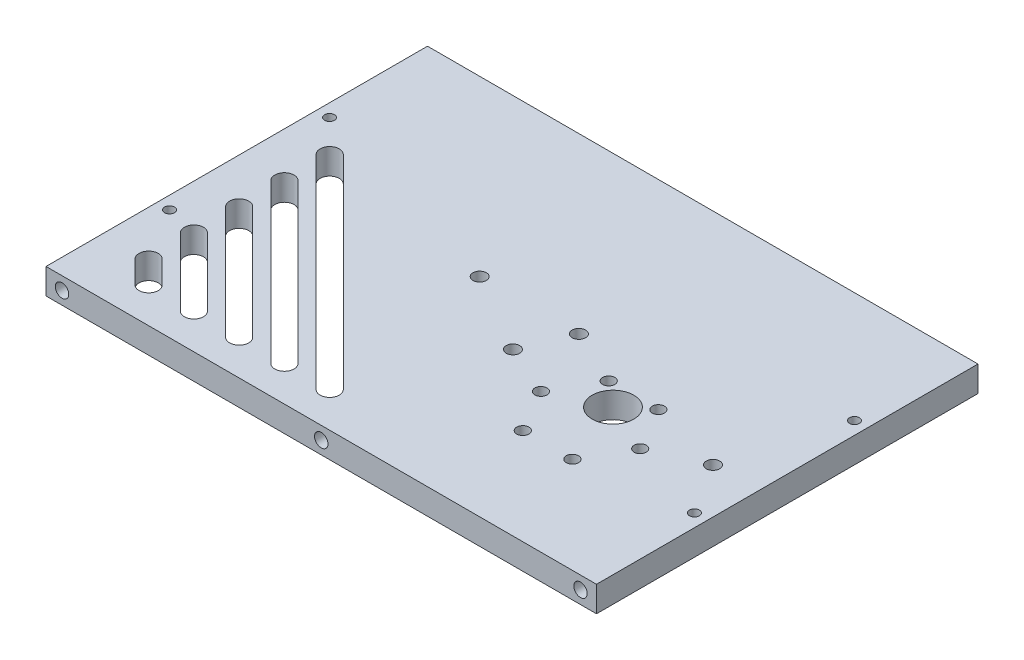
from build123d import *

# Parameters (mm, degrees)
SKETCH1_W           = 172
SKETCH1_H           = 119.2019
BOSS_EXTRUDE1_DEPTH = 8
CUT_EXTRUDE1_REACH  = 211.421
SKETCH2_R           = 6.5
SKETCH2_R_2         = 1.9
SKETCH2_R_3         = 2.1
SKETCH3_R           = 2.1
CUT_EXTRUDE2_DEPTH  = 15
CUT_EXTRUDE3_START  = -104.2019
SKETCH3_3_R         = 2.1
CUT_EXTRUDE3_DEPTH  = 15
CUT_EXTRUDE4_REACH  = 211.421
SKETCH4_R           = 1.55


with BuildPart() as part:
    # Sketch1 → Boss-Extrude1 (new body)
    with BuildSketch(Plane(origin=(0, 0, 0), x_dir=(-1, 0, 0), z_dir=(0, 1, 0))):
        with Locations((86, 59.60095)):
            Rectangle(SKETCH1_W, SKETCH1_H)
    extrude(amount=BOSS_EXTRUDE1_DEPTH)

    # Sketch2 → Cut-Extrude1 (cut, up to next)
    with BuildSketch(Plane.XZ, mode=Mode.PRIVATE) as cut_extrude1_sk1:
        with Locations(Location((-45.35, 68.7019, 0), (0, 0, 270))):
            Circle(SKETCH2_R)
    cut_extrude1_tool1 = extrude(cut_extrude1_sk1.sketch, amount=-CUT_EXTRUDE1_REACH, mode=Mode.PRIVATE) & part.part
    # Sketch2 → Cut-Extrude1 (cut, up to next)
    with BuildSketch(Plane.XZ, mode=Mode.PRIVATE) as cut_extrude1_sk2:
        with Locations(Location((-60.85, 75.7019, 0), (0, 0, 270))):
            Circle(SKETCH2_R_2)
    cut_extrude1_tool2 = extrude(cut_extrude1_sk2.sketch, amount=-CUT_EXTRUDE1_REACH, mode=Mode.PRIVATE) & part.part
    # Sketch2 → Cut-Extrude1 (cut, up to next)
    with BuildSketch(Plane.XZ, mode=Mode.PRIVATE) as cut_extrude1_sk3:
        with Locations(Location((-53.1, 89.125293759, 0), (0, 0, 270))):
            Circle(SKETCH2_R_2)
    cut_extrude1_tool3 = extrude(cut_extrude1_sk3.sketch, amount=-CUT_EXTRUDE1_REACH, mode=Mode.PRIVATE) & part.part
    # Sketch2 → Cut-Extrude1 (cut, up to next)
    with BuildSketch(Plane.XZ, mode=Mode.PRIVATE) as cut_extrude1_sk4:
        with Locations(Location((-37.6, 89.125293759, 0), (0, 0, 270))):
            Circle(SKETCH2_R_2)
    cut_extrude1_tool4 = extrude(cut_extrude1_sk4.sketch, amount=-CUT_EXTRUDE1_REACH, mode=Mode.PRIVATE) & part.part
    # Sketch2 → Cut-Extrude1 (cut, up to next)
    with BuildSketch(Plane.XZ, mode=Mode.PRIVATE) as cut_extrude1_sk5:
        with Locations(Location((-29.85, 75.7019, 0), (0, 0, 270))):
            Circle(SKETCH2_R_2)
    cut_extrude1_tool5 = extrude(cut_extrude1_sk5.sketch, amount=-CUT_EXTRUDE1_REACH, mode=Mode.PRIVATE) & part.part
    # Sketch2 → Cut-Extrude1 (cut, up to next)
    with BuildSketch(Plane.XZ, mode=Mode.PRIVATE) as cut_extrude1_sk6:
        with Locations(Location((-37.6, 62.278506241, 0), (0, 0, 270))):
            Circle(SKETCH2_R_2)
    cut_extrude1_tool6 = extrude(cut_extrude1_sk6.sketch, amount=-CUT_EXTRUDE1_REACH, mode=Mode.PRIVATE) & part.part
    # Sketch2 → Cut-Extrude1 (cut, up to next)
    with BuildSketch(Plane.XZ, mode=Mode.PRIVATE) as cut_extrude1_sk7:
        with Locations(Location((-53.1, 62.278506241, 0), (0, 0, 270))):
            Circle(SKETCH2_R_2)
    cut_extrude1_tool7 = extrude(cut_extrude1_sk7.sketch, amount=-CUT_EXTRUDE1_REACH, mode=Mode.PRIVATE) & part.part
    # Sketch2 → Cut-Extrude1 (cut, up to next)
    with BuildSketch(Plane.XZ, mode=Mode.PRIVATE) as cut_extrude1_sk8:
        with Locations(Location((-76.6, 68.7019, 0), (0, 0, 270))):
            Circle(SKETCH2_R_3)
    cut_extrude1_tool8 = extrude(cut_extrude1_sk8.sketch, amount=-CUT_EXTRUDE1_REACH, mode=Mode.PRIVATE) & part.part
    # Sketch2 → Cut-Extrude1 (cut, up to next)
    with BuildSketch(Plane.XZ, mode=Mode.PRIVATE) as cut_extrude1_sk9:
        with Locations(Location((-14.1, 68.7019, 0), (0, 0, 270))):
            Circle(SKETCH2_R_3)
    cut_extrude1_tool9 = extrude(cut_extrude1_sk9.sketch, amount=-CUT_EXTRUDE1_REACH, mode=Mode.PRIVATE) & part.part
    # Sketch2 → Cut-Extrude1 (cut, up to next)
    with BuildSketch(Plane.XZ, mode=Mode.PRIVATE) as cut_extrude1_sk10:
        with Locations(Location((-70.5, 54.2019, 0), (0, 0, 270))):
            Circle(SKETCH2_R_3)
    cut_extrude1_tool10 = extrude(cut_extrude1_sk10.sketch, amount=-CUT_EXTRUDE1_REACH, mode=Mode.PRIVATE) & part.part
    # Sketch2 → Cut-Extrude1 (cut, up to next)
    with BuildSketch(Plane.XZ, mode=Mode.PRIVATE) as cut_extrude1_sk11:
        with Locations(Location((-101.5, 54.2019, 0), (0, 0, 270))):
            Circle(SKETCH2_R_3)
    cut_extrude1_tool11 = extrude(cut_extrude1_sk11.sketch, amount=-CUT_EXTRUDE1_REACH, mode=Mode.PRIVATE) & part.part
    # Sketch2 → Cut-Extrude1 (cut, up to next)
    with BuildSketch(Plane.XZ, mode=Mode.PRIVATE) as cut_extrude1_sk12:
        with BuildLine():
            Line((-160.121320344, 89.110016908), (-138.908116908, 110.323220344))
            ThreePointArc((-138.908116908, 110.323220344), (-134.665476221, 110.323220344), (-134.665476221, 106.080579656))
            Line((-134.665476221, 106.080579656), (-155.878679656, 84.867376221))
            ThreePointArc((-155.878679656, 84.867376221), (-160.121320344, 84.867376221), (-160.121320344, 89.110016908))
        make_face()
    cut_extrude1_tool12 = extrude(cut_extrude1_sk12.sketch, amount=-CUT_EXTRUDE1_REACH, mode=Mode.PRIVATE) & part.part
    # Sketch2 → Cut-Extrude1 (cut, up to next)
    with BuildSketch(Plane.XZ, mode=Mode.PRIVATE) as cut_extrude1_sk13:
        with BuildLine():
            Line((-160.121320344, 74.967881284), (-124.765981284, 110.323220344))
            ThreePointArc((-124.765981284, 110.323220344), (-120.523340597, 110.323220344), (-120.523340597, 106.080579656))
            Line((-120.523340597, 106.080579656), (-155.878679656, 70.725240597))
            ThreePointArc((-155.878679656, 70.725240597), (-160.121320344, 70.725240597), (-160.121320344, 74.967881284))
        make_face()
    cut_extrude1_tool13 = extrude(cut_extrude1_sk13.sketch, amount=-CUT_EXTRUDE1_REACH, mode=Mode.PRIVATE) & part.part
    # Sketch2 → Cut-Extrude1 (cut, up to next)
    with BuildSketch(Plane.XZ, mode=Mode.PRIVATE) as cut_extrude1_sk14:
        with BuildLine():
            Line((-160.121320344, 60.825745661), (-110.623845661, 110.323220344))
            ThreePointArc((-110.623845661, 110.323220344), (-106.381204973, 110.323220344), (-106.381204973, 106.080579656))
            Line((-106.381204973, 106.080579656), (-155.878679656, 56.583104973))
            ThreePointArc((-155.878679656, 56.583104973), (-160.121320344, 56.583104973), (-160.121320344, 60.825745661))
        make_face()
    cut_extrude1_tool14 = extrude(cut_extrude1_sk14.sketch, amount=-CUT_EXTRUDE1_REACH, mode=Mode.PRIVATE) & part.part
    # Sketch2 → Cut-Extrude1 (cut, up to next)
    with BuildSketch(Plane.XZ, mode=Mode.PRIVATE) as cut_extrude1_sk15:
        with BuildLine():
            Line((-160.121320344, 46.683610037), (-96.481710037, 110.323220344))
            ThreePointArc((-96.481710037, 110.323220344), (-92.23906935, 110.323220344), (-92.23906935, 106.080579656))
            Line((-92.23906935, 106.080579656), (-155.878679656, 42.44096935))
            ThreePointArc((-155.878679656, 42.44096935), (-160.121320344, 42.44096935), (-160.121320344, 46.683610037))
        make_face()
    cut_extrude1_tool15 = extrude(cut_extrude1_sk15.sketch, amount=-CUT_EXTRUDE1_REACH, mode=Mode.PRIVATE) & part.part
    # Sketch2 → Cut-Extrude1 (cut, up to next)
    with BuildSketch(Plane.XZ, mode=Mode.PRIVATE) as cut_extrude1_sk16:
        with BuildLine():
            Line((-160.121320344, 103.252152532), (-153.050252532, 110.323220344))
            ThreePointArc((-153.050252532, 110.323220344), (-148.807611845, 110.323220344), (-148.807611845, 106.080579656))
            Line((-148.807611845, 106.080579656), (-155.878679656, 99.009511845))
            ThreePointArc((-155.878679656, 99.009511845), (-160.121320344, 99.009511845), (-160.121320344, 103.252152532))
        make_face()
    cut_extrude1_tool16 = extrude(cut_extrude1_sk16.sketch, amount=-CUT_EXTRUDE1_REACH, mode=Mode.PRIVATE) & part.part
    add(cut_extrude1_tool1.solids().sort_by_distance((-45.35, 0, 68.7019))[0], mode=Mode.SUBTRACT)
    add(cut_extrude1_tool2.solids().sort_by_distance((-60.85, 0, 75.7019))[0], mode=Mode.SUBTRACT)
    add(cut_extrude1_tool3.solids().sort_by_distance((-53.1, 0, 89.125294))[0], mode=Mode.SUBTRACT)
    add(cut_extrude1_tool4.solids().sort_by_distance((-37.6, 0, 89.125294))[0], mode=Mode.SUBTRACT)
    add(cut_extrude1_tool5.solids().sort_by_distance((-29.85, 0, 75.7019))[0], mode=Mode.SUBTRACT)
    add(cut_extrude1_tool6.solids().sort_by_distance((-37.6, 0, 62.278506))[0], mode=Mode.SUBTRACT)
    add(cut_extrude1_tool7.solids().sort_by_distance((-53.1, 0, 62.278506))[0], mode=Mode.SUBTRACT)
    add(cut_extrude1_tool8.solids().sort_by_distance((-76.6, 0, 68.7019))[0], mode=Mode.SUBTRACT)
    add(cut_extrude1_tool9.solids().sort_by_distance((-14.1, 0, 68.7019))[0], mode=Mode.SUBTRACT)
    add(cut_extrude1_tool10.solids().sort_by_distance((-70.5, 0, 54.2019))[0], mode=Mode.SUBTRACT)
    add(cut_extrude1_tool11.solids().sort_by_distance((-101.5, 0, 54.2019))[0], mode=Mode.SUBTRACT)
    add(cut_extrude1_tool12.solids().sort_by_distance((-147.393398, 0, 97.595298))[0], mode=Mode.SUBTRACT)
    add(cut_extrude1_tool13.solids().sort_by_distance((-140.32233, 0, 90.52423))[0], mode=Mode.SUBTRACT)
    add(cut_extrude1_tool14.solids().sort_by_distance((-133.251263, 0, 83.453163))[0], mode=Mode.SUBTRACT)
    add(cut_extrude1_tool15.solids().sort_by_distance((-126.180195, 0, 76.382095))[0], mode=Mode.SUBTRACT)
    add(cut_extrude1_tool16.solids().sort_by_distance((-154.464466, 0, 104.666366))[0], mode=Mode.SUBTRACT)

    # Sketch3 → Cut-Extrude2 (cut)
    with BuildSketch(Plane(origin=(0, 0, 0), x_dir=(1, 0, 0), z_dir=(0, 0, -1))):
        with Locations(Location((-5, -4, 0), (0, 0, 180))):
            Circle(SKETCH3_R)
        with Locations(Location((-167, -4, 0), (0, 0, 180))):
            Circle(SKETCH3_R)
        with Locations(Location((-86, -4, 0), (0, 0, 180))):
            Circle(SKETCH3_R)
    extrude(amount=-CUT_EXTRUDE2_DEPTH, mode=Mode.SUBTRACT)

    # Sketch3<3> → Cut-Extrude3 (cut)
    with BuildSketch(Plane(origin=(0, 0, 0), x_dir=(1, 0, 0), z_dir=(0, 0, -1)).offset(CUT_EXTRUDE3_START)):
        with Locations(Location((-5, -4, 0), (0, 0, 180))):
            Circle(SKETCH3_3_R)
        with Locations(Location((-167, -4, 0), (0, 0, 180))):
            Circle(SKETCH3_3_R)
        with Locations(Location((-86, -4, 0), (0, 0, 180))):
            Circle(SKETCH3_3_R)
    extrude(amount=-CUT_EXTRUDE3_DEPTH, mode=Mode.SUBTRACT)

    # Sketch4 → Cut-Extrude4 (cut, up to next)
    with BuildSketch(Plane.XZ, mode=Mode.PRIVATE) as cut_extrude4_sk1:
        with Locations(Location((-168, 84.60095, 0), (0, 0, 270))):
            Circle(SKETCH4_R)
    cut_extrude4_tool1 = extrude(cut_extrude4_sk1.sketch, amount=-CUT_EXTRUDE4_REACH, mode=Mode.PRIVATE) & part.part
    # Sketch4 → Cut-Extrude4 (cut, up to next)
    with BuildSketch(Plane.XZ, mode=Mode.PRIVATE) as cut_extrude4_sk2:
        with Locations(Location((-168, 34.60095, 0), (0, 0, 270))):
            Circle(SKETCH4_R)
    cut_extrude4_tool2 = extrude(cut_extrude4_sk2.sketch, amount=-CUT_EXTRUDE4_REACH, mode=Mode.PRIVATE) & part.part
    # Sketch4 → Cut-Extrude4 (cut, up to next)
    with BuildSketch(Plane.XZ, mode=Mode.PRIVATE) as cut_extrude4_sk3:
        with Locations(Location((-4, 34.60095, 0), (0, 0, 270))):
            Circle(SKETCH4_R)
    cut_extrude4_tool3 = extrude(cut_extrude4_sk3.sketch, amount=-CUT_EXTRUDE4_REACH, mode=Mode.PRIVATE) & part.part
    # Sketch4 → Cut-Extrude4 (cut, up to next)
    with BuildSketch(Plane.XZ, mode=Mode.PRIVATE) as cut_extrude4_sk4:
        with Locations(Location((-4, 84.60095, 0), (0, 0, 270))):
            Circle(SKETCH4_R)
    cut_extrude4_tool4 = extrude(cut_extrude4_sk4.sketch, amount=-CUT_EXTRUDE4_REACH, mode=Mode.PRIVATE) & part.part
    add(cut_extrude4_tool1.solids().sort_by_distance((-168, 0, 84.60095))[0], mode=Mode.SUBTRACT)
    add(cut_extrude4_tool2.solids().sort_by_distance((-168, 0, 34.60095))[0], mode=Mode.SUBTRACT)
    add(cut_extrude4_tool3.solids().sort_by_distance((-4, 0, 34.60095))[0], mode=Mode.SUBTRACT)
    add(cut_extrude4_tool4.solids().sort_by_distance((-4, 0, 84.60095))[0], mode=Mode.SUBTRACT)


solid = part.part
